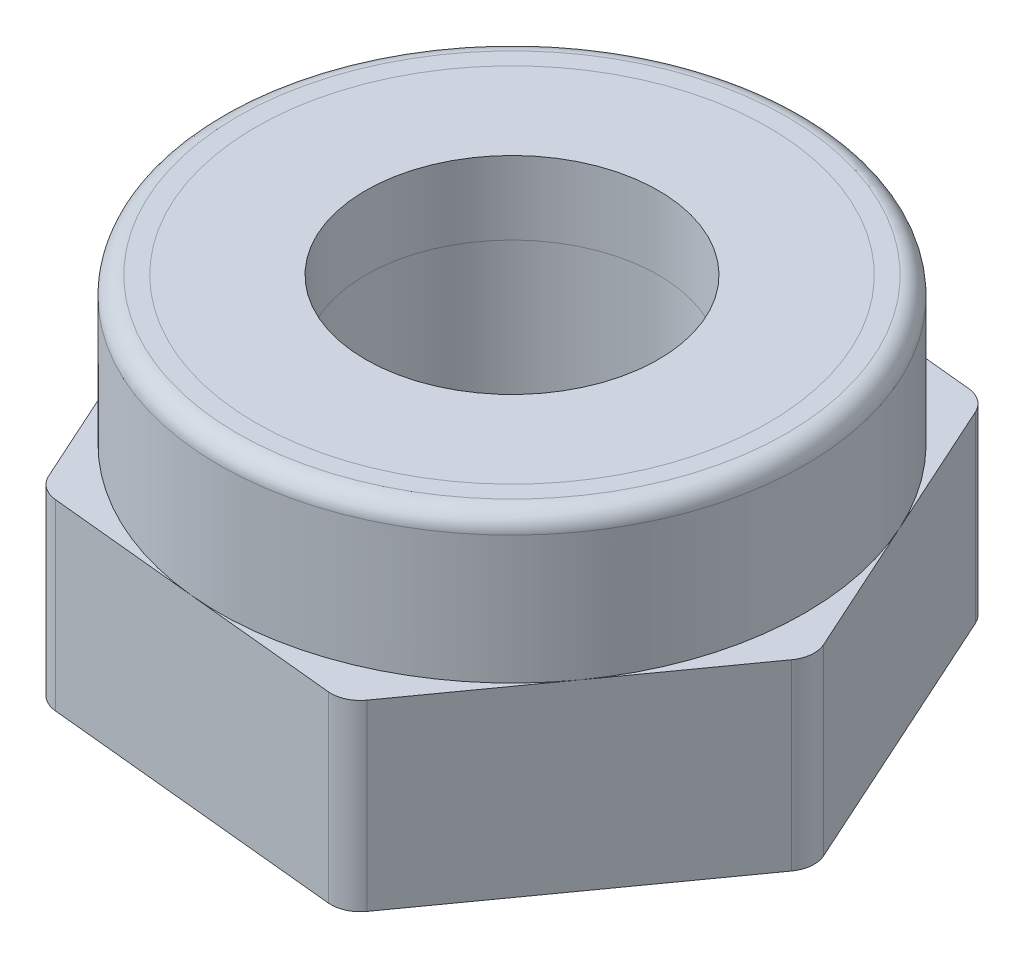
from build123d import *

# Parameters (mm, degrees)
BOSS_EXTRUDE1_DEPTH = 2.5
FILLET1_R           = 0.4
SKETCH2_R           = 4
BOSS_EXTRUDE2_DEPTH = 2
FILLET2_R           = 0.25
SKETCH5_R           = 3.5
SKETCH5_R_2         = 1.25
CUT_EXTRUDE2_DEPTH  = 1
BOSS_EXTRUDE6_START = 1
SKETCH6_R           = 3.5
BOSS_EXTRUDE6_DEPTH = 1
SKETCH7_R           = 2
CUT_EXTRUDE3_DEPTH  = 8.639592547


with BuildPart() as part:
    # Sketch1 → Boss-Extrude1 (new body)
    with BuildSketch(Plane(origin=(0, 0, 0), x_dir=(1, 0, 0), z_dir=(0, 1, 0))):
        Polygon((1.904630432, -4.20781609), (4.596390845, -0.454449706), (2.691760413, 3.753366384), (-1.904630432, 4.20781609), (-4.596390845, 0.454449706), (-2.691760413, -3.753366384), align=None)
    extrude(amount=BOSS_EXTRUDE1_DEPTH)

    # Fillet1
    fillet1_edges = [part.edges().sort_by_distance(p)[0] for p in [
        (-4.596390845, 1.25, -0.454449706),
        (-1.904630432, 1.25, -4.20781609),
        (2.691760413, 1.25, -3.753366384),
        (4.596390845, 1.25, 0.454449706),
        (1.904630432, 1.25, 4.20781609),
        (-2.691760413, 1.25, 3.753366384),
    ]]
    fillet(fillet1_edges, radius=FILLET1_R)

    # Sketch2 → Boss-Extrude2 (add)
    with BuildSketch(Plane(origin=(0, 2.5, 0), x_dir=(1, 0, 0), z_dir=(0, 1, 0))):
        Circle(SKETCH2_R)
    extrude(amount=BOSS_EXTRUDE2_DEPTH)

    # Fillet2
    fillet2_edges = [part.edges().sort_by_distance(p)[0] for p in [
        (-4, 4.5, 0),
    ]]
    fillet(fillet2_edges, radius=FILLET2_R)

    # Sketch5 → Cut-Extrude2 (cut)
    with BuildSketch(Plane(origin=(0, 4.5, 0), x_dir=(1, 0, 0), z_dir=(0, 1, 0))):
        Circle(SKETCH5_R)
        Circle(SKETCH5_R_2, mode=Mode.SUBTRACT)
    extrude(amount=-CUT_EXTRUDE2_DEPTH, mode=Mode.SUBTRACT)


with BuildPart() as body_2:
    # Sketch6 → Boss-Extrude6 (new body)
    with BuildSketch(Plane(origin=(0, 3.5, 0), x_dir=(1, 0, 0), z_dir=(0, 1, 0)).offset(BOSS_EXTRUDE6_START)):
        Circle(SKETCH6_R)
    extrude(amount=-BOSS_EXTRUDE6_DEPTH)


with BuildPart() as cut_extrude3_tool:
    # Sketch7 → Cut-Extrude3 (new, through all)
    with BuildSketch(Plane(origin=(0, 4.5, 0), x_dir=(1, 0, 0), z_dir=(0, 1, 0))):
        Circle(SKETCH7_R)
    extrude(amount=-CUT_EXTRUDE3_DEPTH)


with BuildPart() as part_1:
    add(part.part)

    # Cut-Extrude3: cut by cut_extrude3_tool
    add(cut_extrude3_tool.part, mode=Mode.SUBTRACT)


with BuildPart() as body_2_1:
    add(body_2.part)

    # Cut-Extrude3: cut by cut_extrude3_tool
    add(cut_extrude3_tool.part, mode=Mode.SUBTRACT)


solid = Compound([part_1.part, body_2_1.part])
